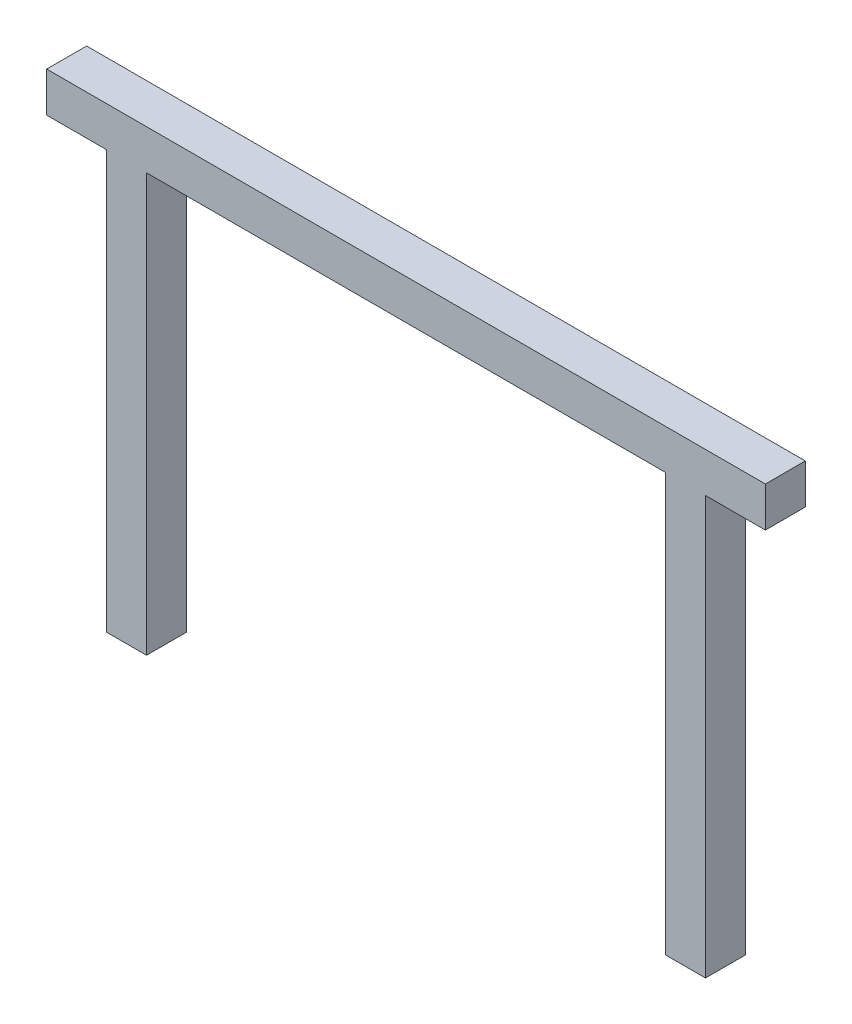
from build123d import *

# Parameters (mm, degrees)
BOSS_EXTRUDE1_DEPTH = 10


with BuildPart() as part:
    # Sketch1 → Boss-Extrude1 (new body)
    with BuildSketch(Plane.XY):
        Polygon((-65, -5), (65, -5), (65, -109.651162791), (75, -109.651162791), (75, -5), (90, -5), (90, 5), (-90, 5), (-90, -5), (-75, -5), (-75, -109.651162791), (-65, -109.651162791), align=None)
    extrude(amount=BOSS_EXTRUDE1_DEPTH)


solid = part.part
